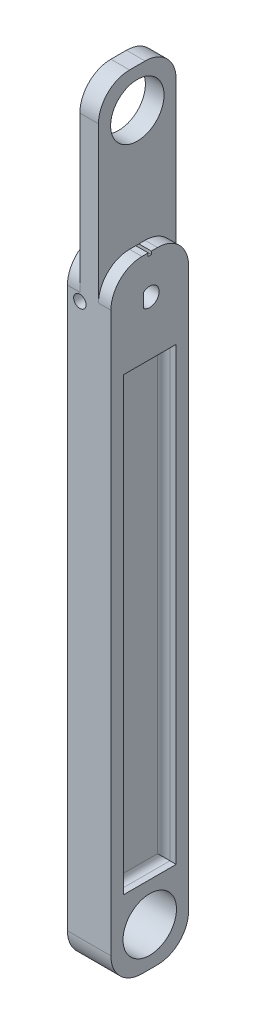
from build123d import *

# Parameters (mm, degrees)
CROQUIS1_W              = 14
CROQUIS1_H              = 25
SALIENTE_EXTRUIR1_DEPTH = 200
REDONDEO1_R             = 10
REDONDEO2_R             = 10
CROQUIS2_R              = 8.6
CORTAR_EXTRUIR1_DEPTH   = 28
CROQUIS14_R             = 9.913044
SALIENTE_EXTRUIR2_DEPTH = 14
CROQUIS12_R             = 2
CORTAR_EXTRUIR7_DEPTH   = 203.042074826
CROQUIS15_W             = 3
CROQUIS15_H             = 5.6
CORTAR_EXTRUIR9_DEPTH   = 8
CROQUIS16_W             = 17
CROQUIS16_H             = 145
CORTAR_EXTRUIR10_DEPTH  = 4
CROQUIS17_W             = 17
CROQUIS17_H             = 145
CORTAR_EXTRUIR11_DEPTH  = 4
REDONDEO5_R             = 2
REDONDEO6_R             = 2
CROQUIS18_W             = 1
CROQUIS18_H             = 1
CORTAR_EXTRUIR12_DEPTH  = 203.042074845
CROQUIS19_W             = 6
CROQUIS19_H             = 25
SALIENTE_EXTRUIR3_DEPTH = 50
CROQUIS20_R             = 8.6
CORTAR_EXTRUIR13_DEPTH  = 6
REDONDEO7_R             = 10
REDONDEO8_R             = 10
REDONDEO9_R             = 10
REDONDEO10_R            = 10
REDONDEO11_R            = 10
REDONDEO12_R            = 10


with BuildPart() as part:
    # Croquis1 → Saliente-Extruir1 (new body)
    with BuildSketch(Plane(origin=(0, 0, 0), x_dir=(1, 0, 0), z_dir=(0, 1, 0))):
        with Locations((7, 12.5)):
            Rectangle(CROQUIS1_W, CROQUIS1_H)
    extrude(amount=SALIENTE_EXTRUIR1_DEPTH)

    # Redondeo1
    redondeo1_edges = [part.edges().sort_by_distance(p)[0] for p in [
        (7, 0, -25),
    ]]
    fillet(redondeo1_edges, radius=REDONDEO1_R)

    # Redondeo2
    redondeo2_edges = [part.edges().sort_by_distance(p)[0] for p in [
        (7, 0, 0),
    ]]
    fillet(redondeo2_edges, radius=REDONDEO2_R)

    # Croquis2 → Cortar-Extruir1 (cut)
    with BuildSketch(Plane(origin=(14, 0, 0), x_dir=(0, 0, -1), z_dir=(1, 0, 0))):
        with Locations((12.5, 12.5)):
            Circle(CROQUIS2_R)
        with BuildLine():
            Line((10.5, 185.263932023), (10.5, 189.736067977))
            ThreePointArc((10.5, 189.736067977), (15.5, 187.5), (10.5, 185.263932023))
        make_face()
    extrude(amount=-CORTAR_EXTRUIR1_DEPTH, mode=Mode.SUBTRACT)

    # Croquis14 → Saliente-Extruir2 (add)
    with BuildSketch(Plane(origin=(14, 0, 0), x_dir=(0, 0, -1), z_dir=(1, 0, 0))):
        with Locations((12.5, 187.5)):
            Circle(CROQUIS14_R)
        with BuildLine():
            Line((10.5, 185.263932023), (10.5, 189.736067977))
            ThreePointArc((10.5, 189.736067977), (15.5, 187.5), (10.5, 185.263932023))
        make_face(mode=Mode.SUBTRACT)
    extrude(amount=-SALIENTE_EXTRUIR2_DEPTH)

    # Croquis12 → Cortar-Extruir7 (cut, through all)
    with BuildSketch(Plane(origin=(0, 0, -25), x_dir=(-1, 0, 0), z_dir=(0, 0, -1))):
        with Locations((-4, 187.5)):
            Circle(CROQUIS12_R)
    extrude(amount=-CORTAR_EXTRUIR7_DEPTH, mode=Mode.SUBTRACT)

    # Croquis15 → Cortar-Extruir9 (cut)
    with BuildSketch(Plane.ZY):
        with Locations((-6.582205818, 187.5)):
            Rectangle(CROQUIS15_W, CROQUIS15_H)
    extrude(amount=-CORTAR_EXTRUIR9_DEPTH, mode=Mode.SUBTRACT)

    # Croquis16 → Cortar-Extruir10 (cut)
    with BuildSketch(Plane.ZY):
        with Locations((-12.5, 97.5)):
            Rectangle(CROQUIS16_W, CROQUIS16_H)
    extrude(amount=-CORTAR_EXTRUIR10_DEPTH, mode=Mode.SUBTRACT)

    # Croquis17 → Cortar-Extruir11 (cut)
    with BuildSketch(Plane(origin=(14, 0, 0), x_dir=(0, 0, -1), z_dir=(1, 0, 0))):
        with Locations((12.5, 97.5)):
            Rectangle(CROQUIS17_W, CROQUIS17_H)
    extrude(amount=-CORTAR_EXTRUIR11_DEPTH, mode=Mode.SUBTRACT)

    # Redondeo5
    redondeo5_edges = [part.edges().sort_by_distance(p)[0] for p in [
        (4, 97.5, -21),
        (4, 170, -12.5),
        (4, 97.5, -4),
        (4, 25, -12.5),
    ]]
    fillet(redondeo5_edges, radius=REDONDEO5_R)

    # Redondeo6
    redondeo6_edges = [part.edges().sort_by_distance(p)[0] for p in [
        (10, 97.5, -21),
        (10, 25, -12.5),
        (10, 97.5, -4),
        (10, 170, -12.5),
    ]]
    fillet(redondeo6_edges, radius=REDONDEO6_R)

    # Croquis18 → Cortar-Extruir12 (cut, through all)
    with BuildSketch(Plane(origin=(14, 0, 0), x_dir=(0, 0, -1), z_dir=(1, 0, 0))):
        with Locations((12.5, 199.5)):
            Rectangle(CROQUIS18_W, CROQUIS18_H)
    extrude(amount=-CORTAR_EXTRUIR12_DEPTH, mode=Mode.SUBTRACT)

    # Croquis19 → Saliente-Extruir3 (add)
    with BuildSketch(Plane(origin=(0, 200, 0), x_dir=(1, 0, 0), z_dir=(0, 1, 0))):
        with Locations((7, 12.5)):
            Rectangle(CROQUIS19_W, CROQUIS19_H)
    extrude(amount=SALIENTE_EXTRUIR3_DEPTH)

    # Croquis20 → Cortar-Extruir13 (cut)
    with BuildSketch(Plane(origin=(10, 0, 0), x_dir=(0, 0, -1), z_dir=(1, 0, 0))):
        with Locations((12.5, 237.5)):
            Circle(CROQUIS20_R)
    extrude(amount=-CORTAR_EXTRUIR13_DEPTH, mode=Mode.SUBTRACT)

    # Redondeo7
    redondeo7_edges = [part.edges().sort_by_distance(p)[0] for p in [
        (7, 250, 0),
    ]]
    fillet(redondeo7_edges, radius=REDONDEO7_R)

    # Redondeo8
    redondeo8_edges = [part.edges().sort_by_distance(p)[0] for p in [
        (7, 250, -25),
    ]]
    fillet(redondeo8_edges, radius=REDONDEO8_R)

    # Redondeo9
    redondeo9_edges = [part.edges().sort_by_distance(p)[0] for p in [
        (2, 200, 0),
    ]]
    fillet(redondeo9_edges, radius=REDONDEO9_R)

    # Redondeo10
    redondeo10_edges = [part.edges().sort_by_distance(p)[0] for p in [
        (12, 200, 0),
    ]]
    fillet(redondeo10_edges, radius=REDONDEO10_R)

    # Redondeo11
    redondeo11_edges = [part.edges().sort_by_distance(p)[0] for p in [
        (12, 200, -25),
    ]]
    fillet(redondeo11_edges, radius=REDONDEO11_R)

    # Redondeo12
    redondeo12_edges = [part.edges().sort_by_distance(p)[0] for p in [
        (2, 200, -25),
    ]]
    fillet(redondeo12_edges, radius=REDONDEO12_R)


solid = part.part
